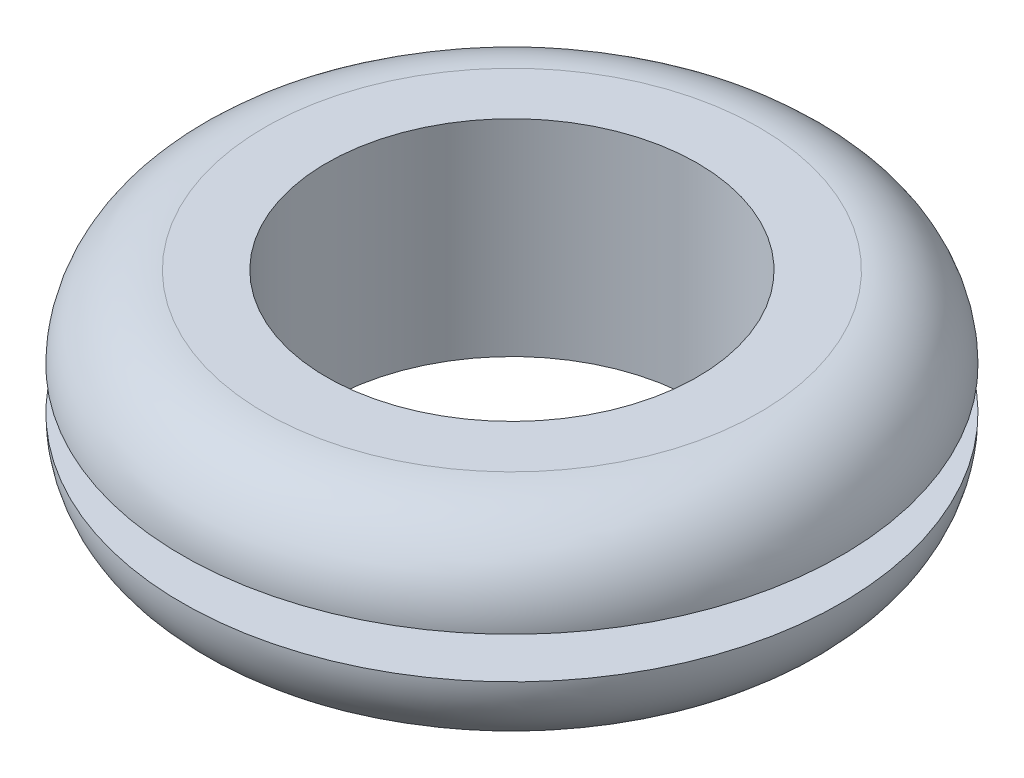
from build123d import *


with BuildPart() as part:
    # Sketch2 → Revolve1 (revolve)
    with BuildSketch(Plane(origin=(0, 0, 0), x_dir=(0, 0, -1), z_dir=(1, 0, 0)), mode=Mode.PRIVATE) as revolve1_sk:
        with BuildLine():
            Line((-7.14375, -3.96875), (-7.14375, 3.96875))
            Line((-7.14375, 3.96875), (-9.525, 3.96875))
            ThreePointArc((-9.525, 3.96875), (-11.77006403, 3.03881403), (-12.7, 0.79375))
            Line((-12.7, 0.79375), (-9.525, 0.79375))
            Line((-9.525, 0.79375), (-9.525, -0.79375))
            Line((-9.525, -0.79375), (-12.7, -0.79375))
            ThreePointArc((-12.7, -0.79375), (-11.77006403, -3.03881403), (-9.525, -3.96875))
            Line((-9.525, -3.96875), (-7.14375, -3.96875))
        make_face()
    revolve(revolve1_sk.sketch.rotate(Axis((0, -3.96875, 0), (0, 1, 0)), 180), axis=Axis((0, -3.96875, 0), (0, 1, 0)))


solid = part.part
